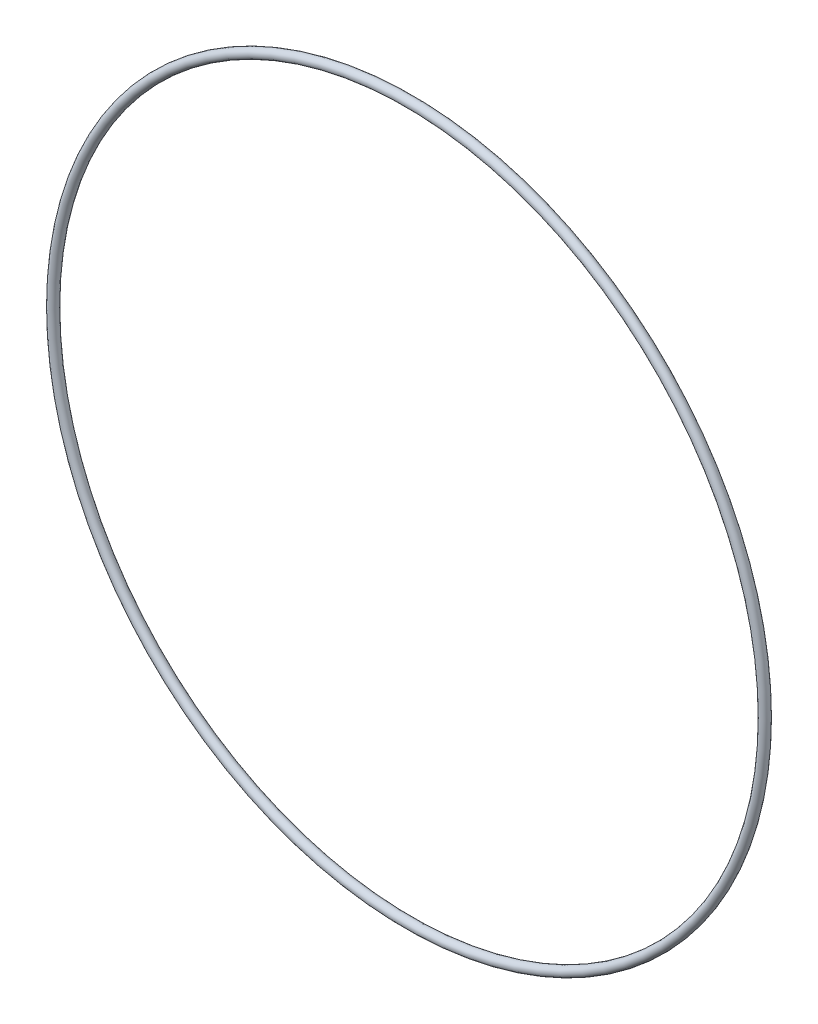
from build123d import *

# Parameters (mm, degrees)
SKETCH1_R = 0.889


with BuildPart() as part:
    # Sketch1 → Revolve1 (revolve)
    with BuildSketch(Plane(origin=(0, 0, 0), x_dir=(0, -1, 0), z_dir=(1, 0, 0)), mode=Mode.PRIVATE) as revolve1_sk:
        with Locations((67.4243, 0)):
            Circle(SKETCH1_R)
    revolve(revolve1_sk.sketch.rotate(Axis((0, 0, 0.889), (0, 0, -1)), 270), axis=Axis((0, 0, 0.889), (0, 0, -1)))


solid = part.part
